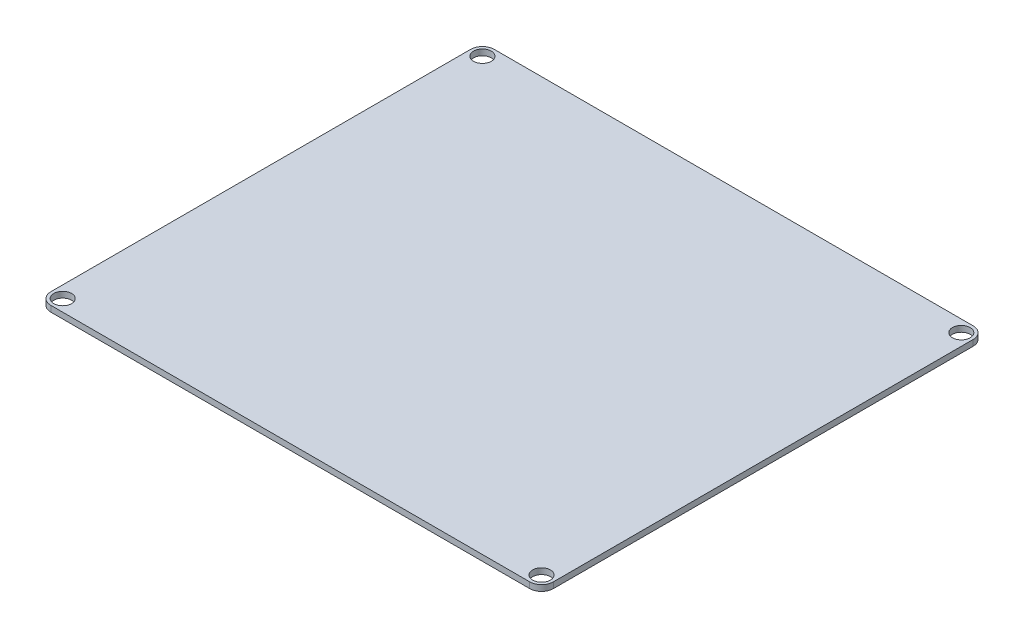
from build123d import *

# Parameters (mm, degrees)
SKETCH1_R           = 1.5
BOSS_EXTRUDE1_DEPTH = 1


with BuildPart() as part:
    # Sketch1 → Boss-Extrude1 (new body)
    with BuildSketch(Plane(origin=(0, 0, 0), x_dir=(1, 0, 0), z_dir=(0, 1, 0))):
        with BuildLine():
            Line((-40.5, -37.5), (40.5, -37.5))
            ThreePointArc((40.5, -37.5), (41.914213562, -36.914213562), (42.5, -35.5))
            Line((42.5, -35.5), (42.5, 35.5))
            ThreePointArc((42.5, 35.5), (41.914213562, 36.914213562), (40.5, 37.5))
            Line((40.5, 37.5), (-40.5, 37.5))
            ThreePointArc((-40.5, 37.5), (-41.914213562, 36.914213562), (-42.5, 35.5))
            Line((-42.5, 35.5), (-42.5, -35.5))
            ThreePointArc((-42.5, -35.5), (-41.914213562, -36.914213562), (-40.5, -37.5))
        make_face()
        with Locations(Location((-40.5, 35.5, 0), (0, 0, 270))):
            Circle(SKETCH1_R, mode=Mode.SUBTRACT)
        with Locations(Location((40.5, 35.5, 0), (0, 0, 270))):
            Circle(SKETCH1_R, mode=Mode.SUBTRACT)
        with Locations(Location((40.5, -35.5, 0), (0, 0, 270))):
            Circle(SKETCH1_R, mode=Mode.SUBTRACT)
        with Locations(Location((-40.5, -35.5, 0), (0, 0, 270))):
            Circle(SKETCH1_R, mode=Mode.SUBTRACT)
    extrude(amount=BOSS_EXTRUDE1_DEPTH)


solid = part.part
